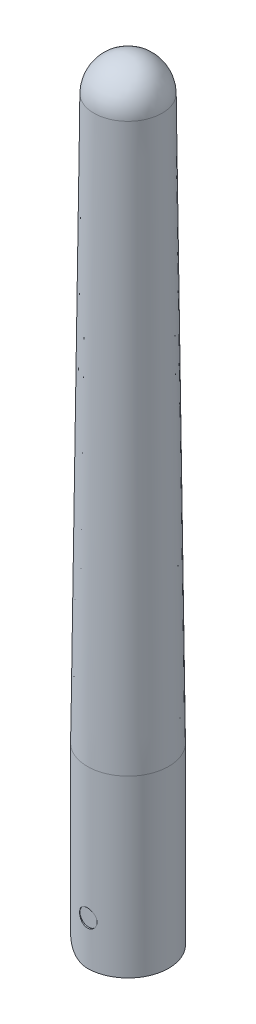
from build123d import *

# Parameters (mm, degrees)
SKETCH2_R           = 1
CUT_EXTRUDE1_DEPTH  = 5
CUT_EXTRUDE2_DEPTH  = 2.5
CUT_EXTRUDE3_DEPTH  = 5
SKETCH5_R           = 1
BOSS_EXTRUDE1_DEPTH = 4.5


with BuildPart() as part:
    # Sketch1 → Revolve1 (revolve)
    with BuildSketch(Plane.XY, mode=Mode.PRIVATE) as revolve1_sk:
        with BuildLine():
            Line((0, 0), (0, 88.2))
            ThreePointArc((0, 88.2), (-2.741592985, 87.073746186), (-3.899734916, 84.345470721))
            Line((-3.899734916, 84.345470721), (-4.65, 20))
            Line((-4.65, 20), (-4.65, 0))
            Line((-4.65, 0), (0, 0))
        make_face()
    revolve(revolve1_sk.sketch.rotate(Axis((0, 0, 0), (0, 1, 0)), 270), axis=Axis((0, 0, 0), (0, 1, 0)))

    # Sketch2 → Cut-Extrude1 (cut, symmetric)
    with BuildSketch(Plane.XY):
        with Locations((0, 5)):
            Circle(SKETCH2_R)
    extrude(amount=CUT_EXTRUDE1_DEPTH, both=True, mode=Mode.SUBTRACT)

    # Sketch3 → Cut-Extrude2 (cut, symmetric)
    with BuildSketch(Plane.XY):
        with BuildLine():
            Line((3, 0), (3, 5))
            ThreePointArc((3, 5), (2.121320344, 7.121320344), (0, 8))
            Line((0, 8), (-4.65, 8))
            Line((-4.65, 8), (-4.65, 0))
            Line((-4.65, 0), (3, 0))
        make_face()
    extrude(amount=CUT_EXTRUDE2_DEPTH, both=True, mode=Mode.SUBTRACT)

    # Sketch4 → Cut-Extrude3 (cut, symmetric)
    with BuildSketch(Plane.XY):
        with BuildLine():
            Line((-5, 5), (-8, 5))
            Line((-8, 5), (-8, -3))
            Line((-8, -3), (0, -3))
            Line((0, -3), (0, 0))
            ThreePointArc((0, 0), (-3.535533906, 1.464466094), (-5, 5))
        make_face()
    extrude(amount=CUT_EXTRUDE3_DEPTH, both=True, mode=Mode.SUBTRACT)

    # Sketch5 → Boss-Extrude1 (add, symmetric)
    with BuildSketch(Plane.XY):
        with Locations((0, 5)):
            Circle(SKETCH5_R)
    extrude(amount=BOSS_EXTRUDE1_DEPTH, both=True)


solid = part.part
